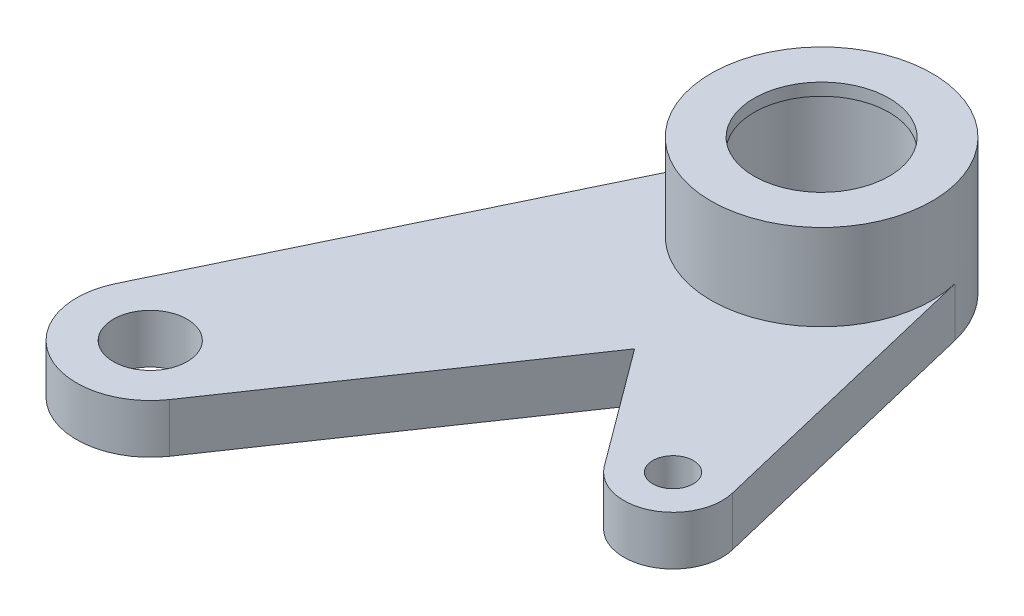
from build123d import *

# Parameters (mm, degrees)
EXTRUDE_1_DEPTH     = 4
SKETCH_3_R          = 9
EXTRUDE_2_DEPTH     = 7
SKETCH_4_R          = 3
CUT_EXTRUDE_1_DEPTH = 49.751330175
SKETCH_5_R          = 6
CUT_EXTRUDE_2_DEPTH = 10
SKETCH_7_R          = 5.5
CUT_EXTRUDE_3_DEPTH = 50.484262082
HOLE_WIZARD_M4_1_D  = 3.3
SCALE1_SCALE        = 2


with BuildPart() as part:
    # 草图1 → 凸台-拉伸1 (new body)
    with BuildSketch(Plane(origin=(0, 0, 0), x_dir=(1, 0, 0), z_dir=(0, 1, 0))):
        with BuildLine():
            Line((-8.109776452, 3.902758754), (-25.406517635, -32.039176982))
            ThreePointArc((-25.406517635, -32.039176982), (-23, -39.837168574), (-15.043482365, -38.022278184))
            Line((-15.043482365, -38.022278184), (0.302963304, -15.526261061))
            Line((0.302963304, -15.526261061), (7.351564548, -25.039059461))
            ThreePointArc((7.351564548, -25.039059461), (12.25592959, -26.282925824), (14.455537758, -21.72642235))
            Line((14.455537758, -21.72642235), (8.752682732, 2.095362733))
            ThreePointArc((8.752682732, 2.095362733), (0.95916746, 8.948742805), (-8.109776452, 3.902758754))
        make_face()
    extrude(amount=EXTRUDE_1_DEPTH)

    # 草图3 → 凸台-拉伸2 (add)
    with BuildSketch(Plane(origin=(0, 4, 0), x_dir=(1, 0, 0), z_dir=(0, 1, 0))):
        with Locations(Location((0, 0, 0), (0, 0, 154.301222305))):
            Circle(SKETCH_3_R)
    extrude(amount=EXTRUDE_2_DEPTH)

    # 草图4 → 切除-拉伸1 (cut, through all)
    with BuildSketch(Plane(origin=(0, 4, 0), x_dir=(1, 0, 0), z_dir=(0, 1, 0))):
        with Locations(Location((-20, -34.641016151, 0), (0, 0, 270))):
            Circle(SKETCH_4_R)
    extrude(amount=-CUT_EXTRUDE_1_DEPTH, mode=Mode.SUBTRACT)

    # 草图5 → 切除-拉伸2 (cut)
    with BuildSketch(Plane.XZ):
        with Locations(Location((0, 0, 0), (0, 0, 270))):
            Circle(SKETCH_5_R)
    extrude(amount=-CUT_EXTRUDE_2_DEPTH, mode=Mode.SUBTRACT)

    # 草图7 → 切除-拉伸3 (cut, through all)
    with BuildSketch(Plane(origin=(0, 11, 0), x_dir=(1, 0, 0), z_dir=(0, 1, 0))):
        with Locations(Location((0, 0, 0), (0, 0, 270))):
            Circle(SKETCH_7_R)
    extrude(amount=-CUT_EXTRUDE_3_DEPTH, mode=Mode.SUBTRACT)

    # M4 螺纹孔1 (through all)
    with Locations(Plane(origin=(0, 4, 0), x_dir=(1, 0, 0), z_dir=(0, 1, 0))):
        with Locations((10.565456544, -22.657694676)):
            Hole(HOLE_WIZARD_M4_1_D / 2)


with BuildPart() as part_1:
    # Scale1: scaled about (-4.168101576, 3.295275318, 12.285042226)
    add(part.part.scale(SCALE1_SCALE).moved(Location((4.168101576, -3.295275318, -12.285042226))))


solid = part_1.part
